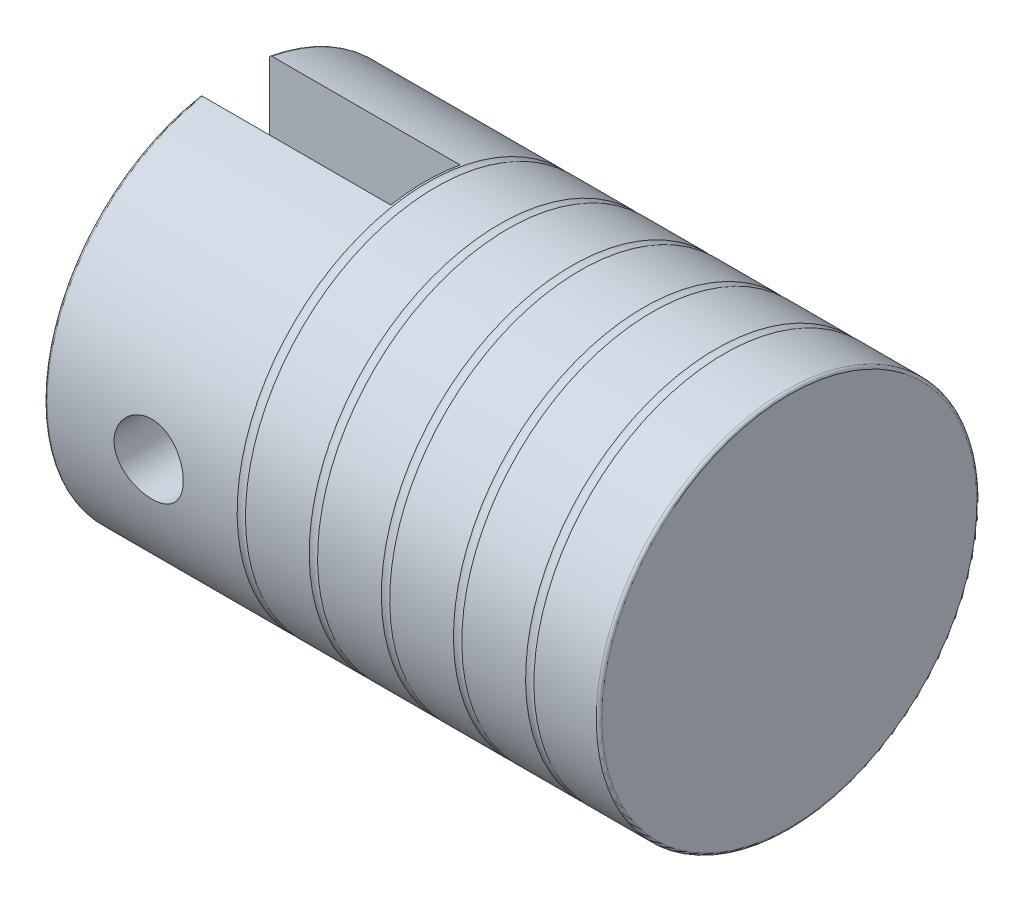
from build123d import *

# Parameters (mm, degrees)
CUT_EXTRUDE1_DEPTH      = 5.08
CUT_EXTRUDE1_DEPTH_BACK = 29.230566018
SKETCH2_R               = 1.6002
CUT_EXTRUDE2_REACH      = 34.011
SKETCH3_R               = 1.58369
SKETCH4_W               = 3.175
SKETCH4_H               = 25.4
CUT_EXTRUDE3_DEPTH      = 8.7376
FILLET1_R               = 0.127


with BuildPart() as part:
    # Sketch1 → Revolve1 (revolve)
    with BuildSketch(Plane.XY):
        with BuildLine():
            Line((22.4155, 8.7122), (25.4, 8.7122))
            Line((25.4, 8.7122), (25.4, 0))
            Line((25.4, 0), (0, 0))
            Line((0, 0), (0, 8.7122))
            Line((0, 8.7122), (8.8265, 8.7122))
            ThreePointArc((8.8265, 8.7122), (9.017, 8.661155679), (9.2075, 8.7122))
            Line((9.2075, 8.7122), (12.1285, 8.7122))
            ThreePointArc((12.1285, 8.7122), (12.319, 8.661155679), (12.5095, 8.7122))
            Line((12.5095, 8.7122), (15.4305, 8.7122))
            ThreePointArc((15.4305, 8.7122), (15.621, 8.661155679), (15.8115, 8.7122))
            Line((15.8115, 8.7122), (18.7325, 8.7122))
            ThreePointArc((18.7325, 8.7122), (18.923, 8.661155679), (19.1135, 8.7122))
            Line((19.1135, 8.7122), (22.0345, 8.7122))
            ThreePointArc((22.0345, 8.7122), (22.225, 8.661155679), (22.4155, 8.7122))
        make_face()
    revolve(axis=Axis((0, 0, 0), (1, 0, 0)))

    # Sketch2 → Cut-Extrude1 (cut, two sides: drawn at the far end of the back side and taken through both)
    with BuildSketch(Plane.XY.offset(-CUT_EXTRUDE1_DEPTH_BACK)):
        with Locations((4.7752, 0)):
            Circle(SKETCH2_R)
    extrude(amount=CUT_EXTRUDE1_DEPTH + CUT_EXTRUDE1_DEPTH_BACK, mode=Mode.SUBTRACT)

    # Sketch3 → Cut-Extrude2 (cut, up to next)
    with BuildSketch(Plane.XY.offset(8.7122), mode=Mode.PRIVATE) as cut_extrude2_sk1:
        with Locations((4.7752, 0)):
            Circle(SKETCH3_R)
    cut_extrude2_tool1 = extrude(cut_extrude2_sk1.sketch, amount=-CUT_EXTRUDE2_REACH, mode=Mode.PRIVATE) & part.part
    add(cut_extrude2_tool1.solids().sort_by_distance((4.7752, 0, 8.7122))[0], mode=Mode.SUBTRACT)

    # Sketch4 → Cut-Extrude3 (cut)
    with BuildSketch(Plane(origin=(0, 0, 0), x_dir=(0, 0, -1), z_dir=(1, 0, 0))):
        Rectangle(SKETCH4_W, SKETCH4_H)
    extrude(amount=CUT_EXTRUDE3_DEPTH, mode=Mode.SUBTRACT)

    # Fillet1
    fillet1_edges = [part.edges().sort_by_distance(p)[0] for p in [
        (25.4, -8.7122, 0),
        (0, 0, -8.7122),
        (0, 0, 8.7122),
    ]]
    fillet(fillet1_edges, radius=FILLET1_R)


solid = part.part
